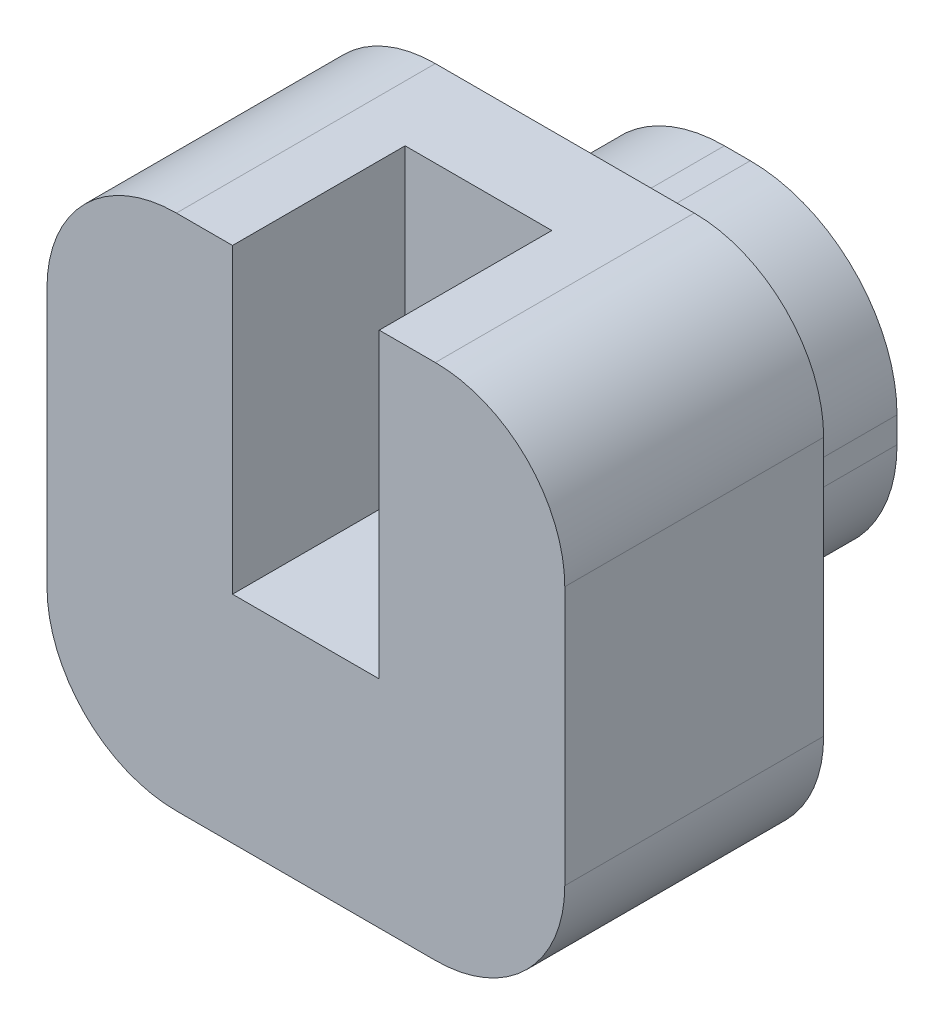
from build123d import *

# Parameters (mm, degrees)
EXTRUDE_1_DEPTH     = 2
EXTRUDE_2_DEPTH     = 3
SKETCH_4_W          = 1.7
SKETCH_4_H          = 2
CUT_EXTRUDE_1_DEPTH = 3.5


with BuildPart() as part:
    # Эскиз1 → Бобышка-Вытянуть1 (new body)
    with BuildSketch(Plane.XY):
        with BuildLine():
            Line((-0.15, -1.85), (0.15, -1.85))
            ThreePointArc((0.15, -1.85), (1.352081528, -1.352081528), (1.85, -0.15))
            Line((1.85, -0.15), (1.85, 0.15))
            ThreePointArc((1.85, 0.15), (1.352081528, 1.352081528), (0.15, 1.85))
            Line((0.15, 1.85), (-0.15, 1.85))
            ThreePointArc((-0.15, 1.85), (-1.352081528, 1.352081528), (-1.85, 0.15))
            Line((-1.85, 0.15), (-1.85, -0.15))
            ThreePointArc((-1.85, -0.15), (-1.352081528, -1.352081528), (-0.15, -1.85))
        make_face()
    extrude(amount=EXTRUDE_1_DEPTH)

    # Эскиз2 → Бобышка-Вытянуть2 (add)
    with BuildSketch(Plane.XY.offset(2)):
        with BuildLine():
            Line((-1.5, -3), (1.5, -3))
            ThreePointArc((1.5, -3), (2.560660172, -2.560660172), (3, -1.5))
            Line((3, -1.5), (3, 1.5))
            ThreePointArc((3, 1.5), (2.560660172, 2.560660172), (1.5, 3))
            Line((1.5, 3), (-1.5, 3))
            ThreePointArc((-1.5, 3), (-2.560660172, 2.560660172), (-3, 1.5))
            Line((-3, 1.5), (-3, -1.5))
            ThreePointArc((-3, -1.5), (-2.560660172, -2.560660172), (-1.5, -3))
        make_face()
    extrude(amount=EXTRUDE_2_DEPTH)

    # Эскиз4 → Вырез-Вытянуть1 (cut)
    with BuildSketch(Plane(origin=(0, 3, 0), x_dir=(1, 0, 0), z_dir=(0, 1, 0))):
        with Locations((0, -4)):
            Rectangle(SKETCH_4_W, SKETCH_4_H)
    extrude(amount=-CUT_EXTRUDE_1_DEPTH, mode=Mode.SUBTRACT)


solid = part.part
